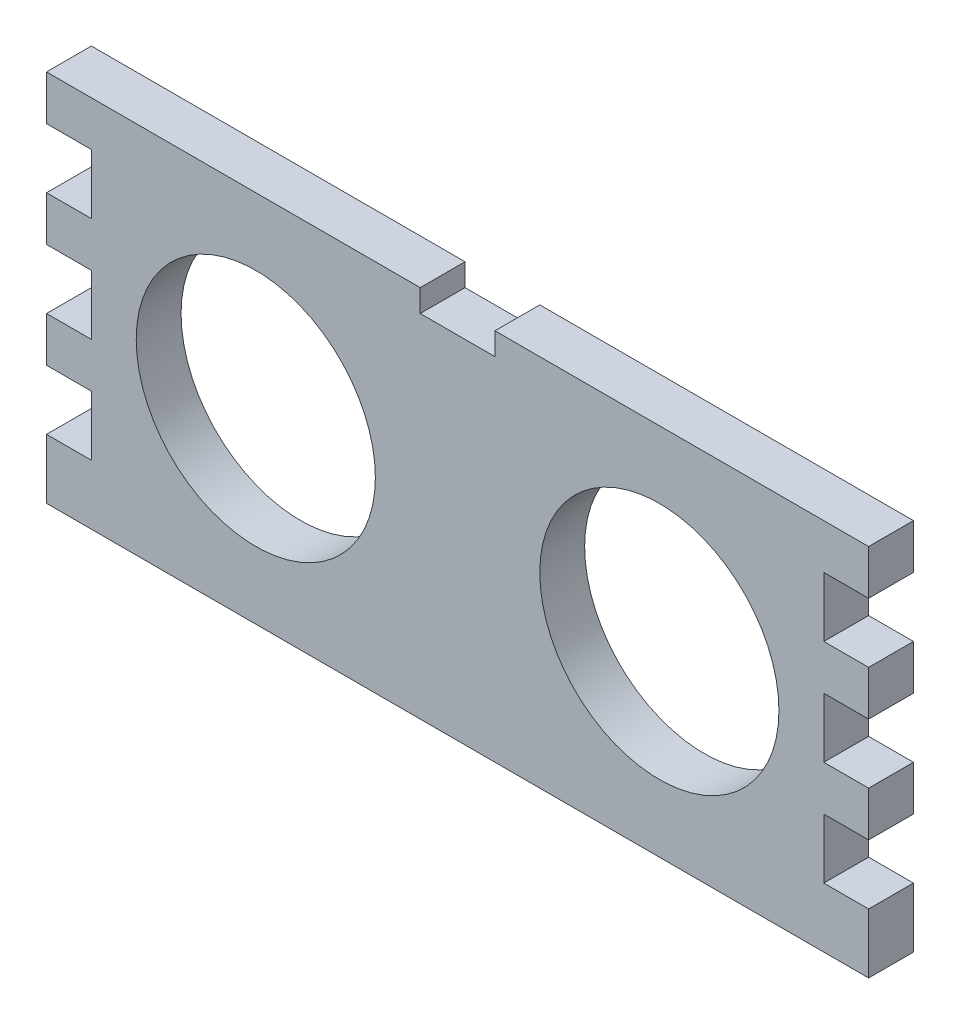
from build123d import *

# Parameters (mm, degrees)
SKETCH1_W           = 55
SKETCH1_H           = 25
BOSS_EXTRUDE1_DEPTH = 3
SKETCH2_R           = 8
CUT_EXTRUDE1_DEPTH  = 3
SKETCH3_W           = 3
SKETCH3_H           = 4
CUT_EXTRUDE2_DEPTH  = 3
SKETCH4_W           = 3
SKETCH4_H           = 4
CUT_EXTRUDE3_DEPTH  = 3
SKETCH5_W           = 5
SKETCH5_H           = 1.5
CUT_EXTRUDE4_DEPTH  = 10


with BuildPart() as part:
    # Sketch1 → Boss-Extrude1 (new body)
    with BuildSketch(Plane.XY):
        Rectangle(SKETCH1_W, SKETCH1_H)
    extrude(amount=BOSS_EXTRUDE1_DEPTH)

    # Sketch2 → Cut-Extrude1 (cut)
    with BuildSketch(Plane.XY.offset(3)):
        with Locations((-13.5, 0)):
            Circle(SKETCH2_R)
        with Locations((13.5, 0)):
            Circle(SKETCH2_R)
    extrude(amount=-CUT_EXTRUDE1_DEPTH, mode=Mode.SUBTRACT)

    # Sketch3 → Cut-Extrude2 (cut)
    with BuildSketch(Plane.XY.offset(3)):
        with Locations((-26, 7.5)):
            Rectangle(SKETCH3_W, SKETCH3_H)
        with Locations((-26, 0.5)):
            Rectangle(SKETCH3_W, SKETCH3_H)
        with Locations((-26, -6.5)):
            Rectangle(SKETCH3_W, SKETCH3_H)
    extrude(amount=-CUT_EXTRUDE2_DEPTH, mode=Mode.SUBTRACT)

    # Sketch4 → Cut-Extrude3 (cut)
    with BuildSketch(Plane.XY.offset(3)):
        with Locations((26, 7.5)):
            Rectangle(SKETCH4_W, SKETCH4_H)
        with Locations((26, 0.5)):
            Rectangle(SKETCH4_W, SKETCH4_H)
        with Locations((26, -6.5)):
            Rectangle(SKETCH4_W, SKETCH4_H)
    extrude(amount=-CUT_EXTRUDE3_DEPTH, mode=Mode.SUBTRACT)

    # Sketch5 → Cut-Extrude4 (cut)
    with BuildSketch(Plane.XY.offset(3)):
        with Locations((0, 11.75)):
            Rectangle(SKETCH5_W, SKETCH5_H)
    extrude(amount=-CUT_EXTRUDE4_DEPTH, mode=Mode.SUBTRACT)


solid = part.part
